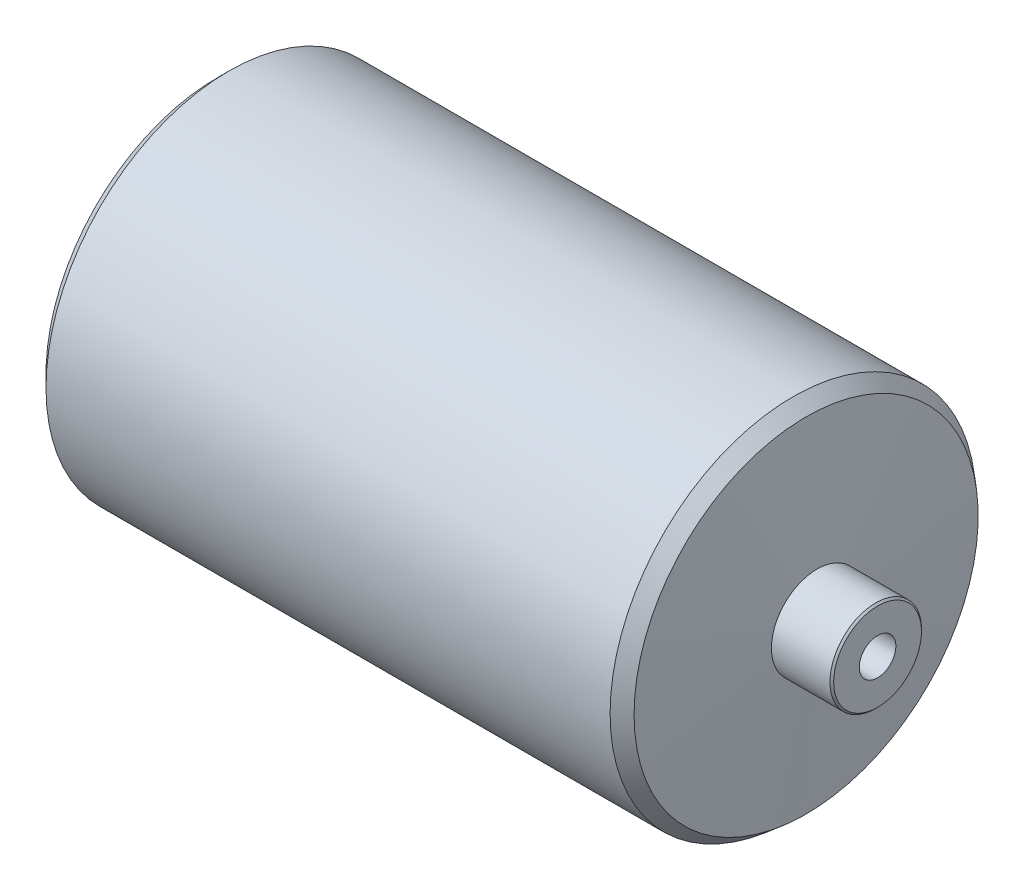
from build123d import *
from OCP.BRepFilletAPI import BRepFilletAPI_MakeChamfer

# Parameters (mm, degrees)
CHAFL_N1_SIZE  = 3
CHAFL_N1_SIZE2 = 3.300188603
CHAFL_N2_SIZE  = 0.5


with BuildPart() as part:
    # Croquis1 → Revolución1 (revolve)
    with BuildSketch(Plane.XY, mode=Mode.PRIVATE) as revoluci_n1_sk:
        Polygon((114.5, 12.5), (98, 12.5), (98, 5), (157, 5), (157, 0), (239, 0), (239, 5), (298, 5), (298, 12.5), (281.5, 12.5), (278.219175118, 50), (117.780824882, 50), align=None)
    revolve(revoluci_n1_sk.sketch.rotate(Axis((26.636942393, 0, 0), (1, 0, 0)), 90), axis=Axis((26.636942393, 0, 0), (1, 0, 0)))

    # Chaflán1: one chamfer whose edges measure the first distance from different faces: ONE call of the kernel's chamfer builder (chamfer() names one face for all edges)
    chafl_n1_edges_1 = [part.edges().sort_by_distance(p)[0] for p in [
        (117.780824882, 0, -50),
    ]]
    chafl_n1_side_1 = [part.faces().sort_by_distance(p)[0] for p in [
        (198, 0, -50),
    ]]
    chafl_n1_edges_2 = [part.edges().sort_by_distance(p)[0] for p in [
        (278.219175118, 0, -50),
    ]]
    chafl_n1_side_2 = [part.faces().sort_by_distance(p)[0] for p in [
        (279.859587559, 0, -31.25),
    ]]
    chafl_n1 = BRepFilletAPI_MakeChamfer(part.part.solid().wrapped)
    for e in chafl_n1_edges_1:
        chafl_n1.Add(CHAFL_N1_SIZE, CHAFL_N1_SIZE2, e.wrapped, chafl_n1_side_1[0].wrapped)  # the first distance lies on this face
    for e in chafl_n1_edges_2:
        chafl_n1.Add(CHAFL_N1_SIZE, CHAFL_N1_SIZE2, e.wrapped, chafl_n1_side_2[0].wrapped)  # the first distance lies on this face
    add(Compound.cast(chafl_n1.Shape()), mode=Mode.REPLACE)

    # Chaflán2
    chafl_n2_edges = [part.edges().sort_by_distance(p)[0] for p in [
        (298, 0, -12.5),
        (98, 0, -12.5),
    ]]
    chamfer(chafl_n2_edges, length=CHAFL_N2_SIZE)


solid = part.part
